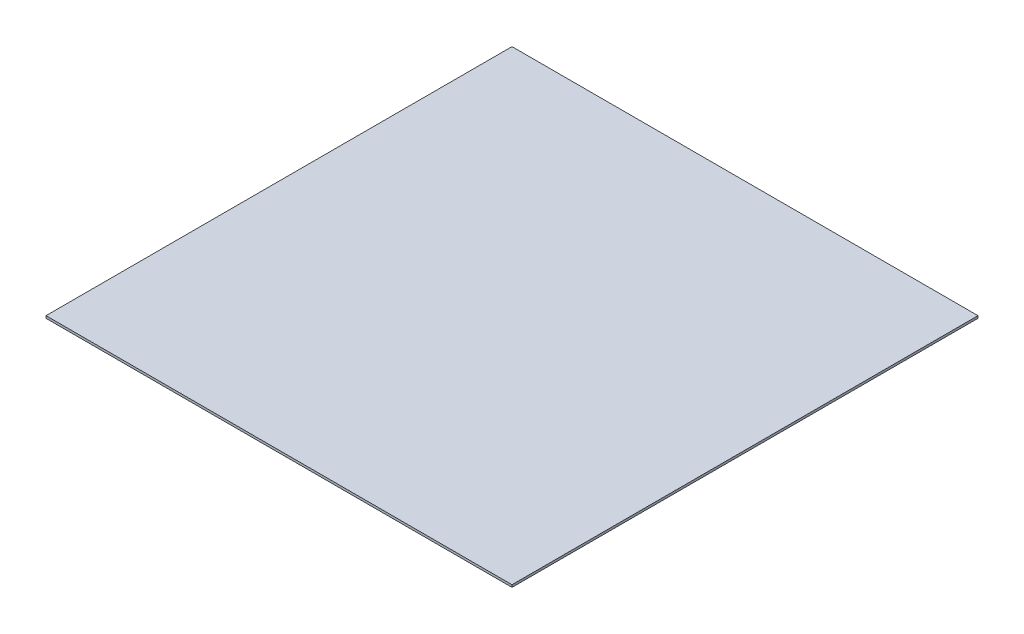
from build123d import *

# Parameters (mm, degrees)
SKETCH1_W           = 2540
SKETCH1_H           = 2540
BOSS_EXTRUDE1_DEPTH = 12.7


with BuildPart() as part:
    # Sketch1 → Boss-Extrude1 (new body)
    with BuildSketch(Plane(origin=(0, 0, 0), x_dir=(1, 0, 0), z_dir=(0, 1, 0))):
        with Locations((1270, 1270)):
            Rectangle(SKETCH1_W, SKETCH1_H)
    extrude(amount=BOSS_EXTRUDE1_DEPTH)


solid = part.part
